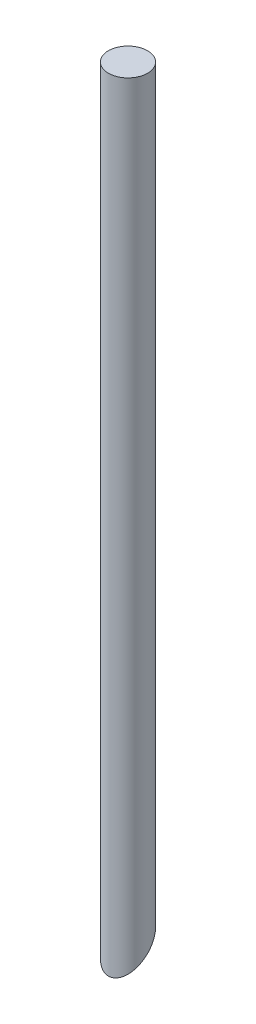
from build123d import *

# Parameters (mm, degrees)
SKETCH_1_R               = 5
EXTRUDE_1_DEPTH          = 200
CUT_EXTRUDE_1_DEPTH      = 201.124960962
CUT_EXTRUDE_1_DEPTH_BACK = 201.124960962


with BuildPart() as part:
    # 草图1 → 凸台-拉伸1 (new body)
    with BuildSketch(Plane(origin=(0, 0, 0), x_dir=(1, 0, 0), z_dir=(0, 1, 0))):
        with Locations(Location((0, 0, 0), (0, 0, 270))):
            Circle(SKETCH_1_R)
    extrude(amount=EXTRUDE_1_DEPTH)

    # 草图2 → 切除-拉伸1 (cut, two sides: drawn at the far end of the back side and taken through both)
    with BuildSketch(Plane(origin=(0, 0, 0), x_dir=(0, 0, -1), z_dir=(1, 0, 0)).offset(-CUT_EXTRUDE_1_DEPTH_BACK)):
        Polygon((-5, 0), (5, 10), (5, 0), align=None)
    extrude(amount=CUT_EXTRUDE_1_DEPTH + CUT_EXTRUDE_1_DEPTH_BACK, mode=Mode.SUBTRACT)


solid = part.part
